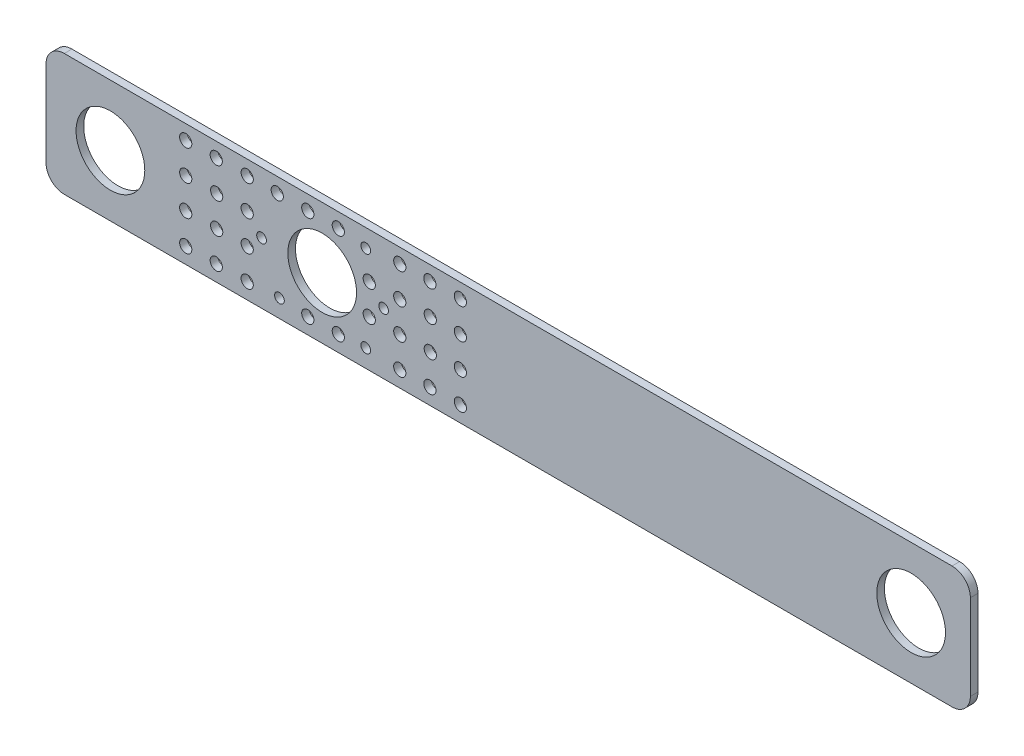
from build123d import *

# Parameters (mm, degrees)
SKETCH1_W           = 384.714130078
SKETCH1_H           = 50.8
SKETCH1_R           = 14.3002
SKETCH1_R_2         = 2.0193
SKETCH1_R_3         = 2.54
BOSS_EXTRUDE1_DEPTH = 3.175
FILLET1_R           = 7.62


with BuildPart() as part:
    # Sketch1 → Boss-Extrude1 (new body)
    with BuildSketch(Plane.XY):
        with Locations((91.437616825, 0.672961839)):
            Rectangle(SKETCH1_W, SKETCH1_H)
        with Locations((-74.109858368, 0.672961839)):
            Circle(SKETCH1_R, mode=Mode.SUBTRACT)
        with Locations((14.028141632, 0.672961839)):
            Circle(SKETCH1_R, mode=Mode.SUBTRACT)
        with Locations((259.138141632, 0.672961839)):
            Circle(SKETCH1_R, mode=Mode.SUBTRACT)
        with Locations((39.592109109, 0.662961839)):
            Circle(SKETCH1_R_2, mode=Mode.SUBTRACT)
        with Locations((32.152621351, -17.297550403)):
            Circle(SKETCH1_R_2, mode=Mode.SUBTRACT)
        with Locations((-3.768403133, -17.297550403)):
            Circle(SKETCH1_R_2, mode=Mode.SUBTRACT)
        with Locations((32.152621351, 18.623474081)):
            Circle(SKETCH1_R_2, mode=Mode.SUBTRACT)
        with Locations((-11.207890891, 0.662961839)):
            Circle(SKETCH1_R_2, mode=Mode.SUBTRACT)
        with Locations((-29.885519869, 7.289574438)):
            Circle(SKETCH1_R_3, mode=Mode.SUBTRACT)
        with Locations((-29.885519869, -5.410425562)):
            Circle(SKETCH1_R_3, mode=Mode.SUBTRACT)
        with Locations((-17.185519869, 7.289574438)):
            Circle(SKETCH1_R_3, mode=Mode.SUBTRACT)
        with Locations((-17.185519869, -5.410425562)):
            Circle(SKETCH1_R_3, mode=Mode.SUBTRACT)
        with Locations((-17.185519869, -18.110425562)):
            Circle(SKETCH1_R_3, mode=Mode.SUBTRACT)
        with Locations((-17.185519869, 19.989574438)):
            Circle(SKETCH1_R_3, mode=Mode.SUBTRACT)
        with Locations((-30.066807854, 19.989574438)):
            Circle(SKETCH1_R_3, mode=Mode.SUBTRACT)
        with Locations((33.614480131, -5.410425562)):
            Circle(SKETCH1_R_3, mode=Mode.SUBTRACT)
        with Locations((33.614480131, 7.289574438)):
            Circle(SKETCH1_R_3, mode=Mode.SUBTRACT)
        with Locations((59.014480131, -5.410425562)):
            Circle(SKETCH1_R_3, mode=Mode.SUBTRACT)
        with Locations((59.014480131, 7.289574438)):
            Circle(SKETCH1_R_3, mode=Mode.SUBTRACT)
        with Locations((46.314480131, 7.289574438)):
            Circle(SKETCH1_R_3, mode=Mode.SUBTRACT)
        with Locations((46.314480131, -5.410425562)):
            Circle(SKETCH1_R_3, mode=Mode.SUBTRACT)
        with Locations((46.314480131, -18.110425562)):
            Circle(SKETCH1_R_3, mode=Mode.SUBTRACT)
        with Locations((58.833192146, -18.110425562)):
            Circle(SKETCH1_R_3, mode=Mode.SUBTRACT)
        with Locations((71.533192146, -18.110425562)):
            Circle(SKETCH1_R_3, mode=Mode.SUBTRACT)
        with Locations((71.533192146, -5.410425562)):
            Circle(SKETCH1_R_3, mode=Mode.SUBTRACT)
        with Locations((71.533192146, 7.289574438)):
            Circle(SKETCH1_R_3, mode=Mode.SUBTRACT)
        with Locations((71.533192146, 19.989574438)):
            Circle(SKETCH1_R_3, mode=Mode.SUBTRACT)
        with Locations((58.833192146, 19.989574438)):
            Circle(SKETCH1_R_3, mode=Mode.SUBTRACT)
        with Locations((46.314480131, 19.989574438)):
            Circle(SKETCH1_R_3, mode=Mode.SUBTRACT)
        with Locations((20.733192146, 19.989574438)):
            Circle(SKETCH1_R_3, mode=Mode.SUBTRACT)
        with Locations((8.033192146, 19.989574438)):
            Circle(SKETCH1_R_3, mode=Mode.SUBTRACT)
        with Locations((-4.666807854, 19.989574438)):
            Circle(SKETCH1_R_3, mode=Mode.SUBTRACT)
        with Locations((20.733192146, -18.110425562)):
            Circle(SKETCH1_R_3, mode=Mode.SUBTRACT)
        with Locations((8.033192146, -18.110425562)):
            Circle(SKETCH1_R_3, mode=Mode.SUBTRACT)
        with Locations((-30.066807854, -18.110425562)):
            Circle(SKETCH1_R_3, mode=Mode.SUBTRACT)
        with Locations((-42.766807854, -18.110425562)):
            Circle(SKETCH1_R_3, mode=Mode.SUBTRACT)
        with Locations((-42.766807854, 19.989574438)):
            Circle(SKETCH1_R_3, mode=Mode.SUBTRACT)
        with Locations((-42.766807854, 7.289574438)):
            Circle(SKETCH1_R_3, mode=Mode.SUBTRACT)
        with Locations((-42.766807854, -5.410425562)):
            Circle(SKETCH1_R_3, mode=Mode.SUBTRACT)
    extrude(amount=BOSS_EXTRUDE1_DEPTH)

    # Fillet1
    fillet1_edges = [part.edges().sort_by_distance(p)[0] for p in [
        (-100.919448214, 26.072961839, 1.5875),
        (283.794681864, 26.072961839, 1.5875),
        (283.794681864, -24.727038161, 1.5875),
        (-100.919448214, -24.727038161, 1.5875),
    ]]
    fillet(fillet1_edges, radius=FILLET1_R)


solid = part.part
